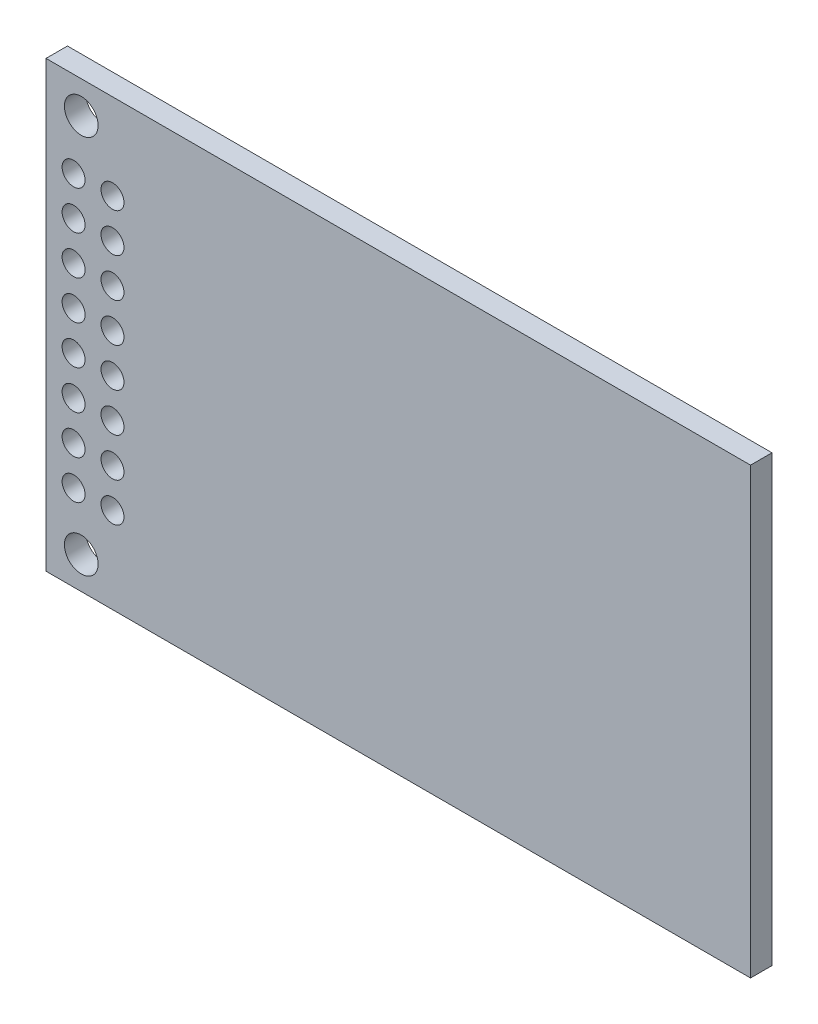
from build123d import *

# Parameters (mm, degrees)
ESBO_O1_W                = 46
ESBO_O1_H                = 29
RESSALTO_EXTRUS_O1_DEPTH = 1.4
ESBO_O2_R                = 1.1
ESBO_O2_R_2              = 0.75
CORTE_EXTRUS_O1_DEPTH    = 28.225172176


with BuildPart() as part:
    # Esboço1 → Ressalto-extrusão1 (new body)
    with BuildSketch(Plane.XY):
        Rectangle(ESBO_O1_W, ESBO_O1_H)
    extrude(amount=RESSALTO_EXTRUS_O1_DEPTH)

    # Esboço2 → Corte-extrusão1 (cut, through all)
    with BuildSketch(Plane.XY.offset(1.4)):
        with Locations((-20.7, 12.4)):
            Circle(ESBO_O2_R)
        with Locations(Location((-20.7, -12.4, 0), (0, 0, 180))):
            Circle(ESBO_O2_R)
        with Locations((-21.2, 8.89)):
            Circle(ESBO_O2_R_2)
        with Locations((-18.66, 8.89)):
            Circle(ESBO_O2_R_2)
        with Locations((-18.66, 6.35)):
            Circle(ESBO_O2_R_2)
        with Locations((-18.66, 3.81)):
            Circle(ESBO_O2_R_2)
        with Locations((-18.66, 1.27)):
            Circle(ESBO_O2_R_2)
        with Locations((-18.66, -1.27)):
            Circle(ESBO_O2_R_2)
        with Locations((-18.66, -3.81)):
            Circle(ESBO_O2_R_2)
        with Locations((-18.66, -6.35)):
            Circle(ESBO_O2_R_2)
        with Locations((-18.66, -8.89)):
            Circle(ESBO_O2_R_2)
        with Locations((-21.2, 6.35)):
            Circle(ESBO_O2_R_2)
        with Locations((-21.2, 3.81)):
            Circle(ESBO_O2_R_2)
        with Locations((-21.2, 1.27)):
            Circle(ESBO_O2_R_2)
        with Locations((-21.2, -1.27)):
            Circle(ESBO_O2_R_2)
        with Locations((-21.2, -3.81)):
            Circle(ESBO_O2_R_2)
        with Locations((-21.2, -6.35)):
            Circle(ESBO_O2_R_2)
        with Locations((-21.2, -8.89)):
            Circle(ESBO_O2_R_2)
    extrude(amount=-CORTE_EXTRUS_O1_DEPTH, mode=Mode.SUBTRACT)


solid = part.part
